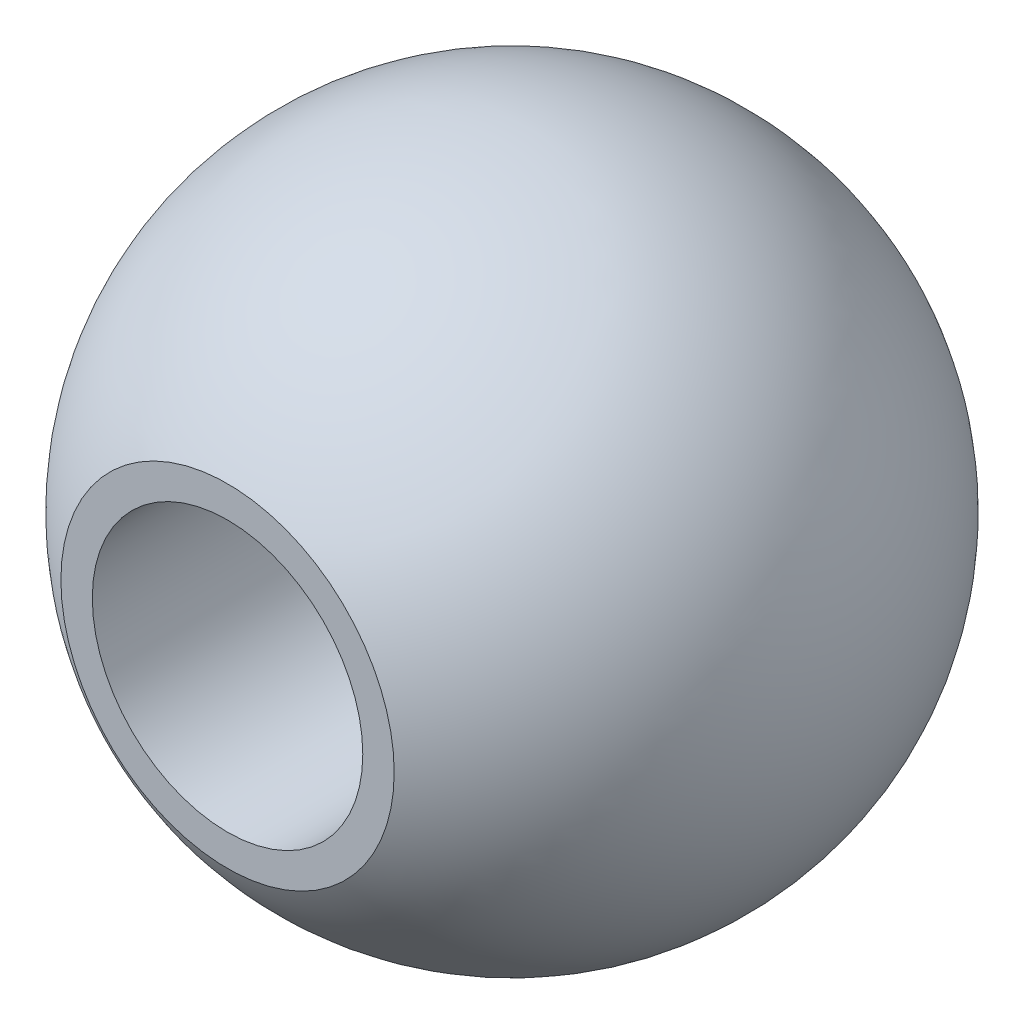
from build123d import *

# Parameters (mm, degrees)
CUT_EXTRUDE1_REACH = 10.701
SKETCH2_R          = 1.6


with BuildPart() as part:
    # Sketch1 → Revolve1 (revolve)
    with BuildSketch(Plane(origin=(0, 0, 0), x_dir=(1, 0, 0), z_dir=(0, 1, 0))):
        with BuildLine():
            Line((0, 3.365), (0, -3.365))
            Line((0, -3.365), (1.971490553, -3.365))
            ThreePointArc((1.971490553, -3.365), (3.9, 0), (1.971490553, 3.365))
            Line((1.971490553, 3.365), (0, 3.365))
        make_face()
    revolve(axis=Axis((0, 0, -3.365), (0, 0, 1)))

    # Sketch2 → Cut-Extrude1 (cut, up to next)
    with BuildSketch(Plane.XY.offset(3.365), mode=Mode.PRIVATE) as cut_extrude1_sk1:
        Circle(SKETCH2_R)
    cut_extrude1_tool1 = extrude(cut_extrude1_sk1.sketch, amount=-CUT_EXTRUDE1_REACH, mode=Mode.PRIVATE) & part.part
    add(cut_extrude1_tool1.solids().sort_by_distance((0, 0, 3.365))[0], mode=Mode.SUBTRACT)


solid = part.part
